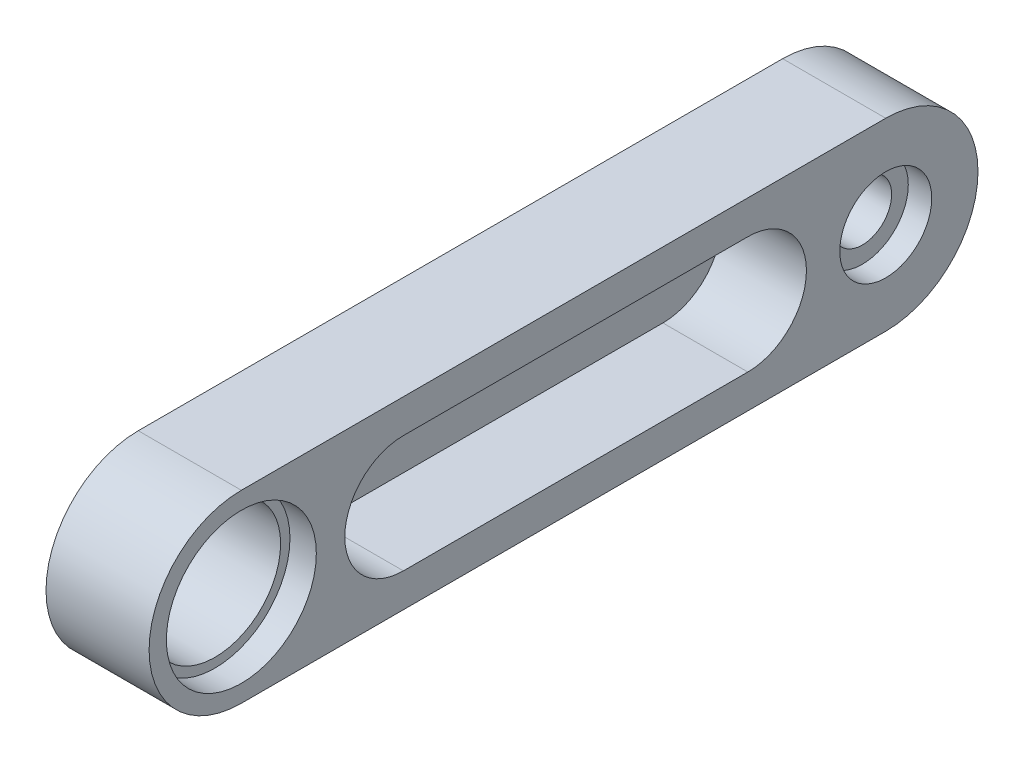
from build123d import *

# Parameters (mm, degrees)
SKETCH1_R           = 2.8448
SKETCH1_R_2         = 1.27
BOSS_EXTRUDE1_DEPTH = 4.4704
SKETCH2_R           = 3.2512
CUT_EXTRUDE1_DEPTH  = 1.143
SKETCH3_R           = 1.9939
CUT_EXTRUDE2_DEPTH  = 1.016
CUT_EXTRUDE3_DEPTH  = 3.683
SCALE1_SCALE        = 0.6


with BuildPart() as part:
    # Sketch1 → Boss-Extrude1 (new body)
    with BuildSketch(Plane(origin=(0, 0, 0), x_dir=(0, 0, -1), z_dir=(1, 0, 0))):
        with BuildLine():
            Line((0, 4.000000128), (27.94, 4.000000128))
            ThreePointArc((27.94, 4.000000128), (31.940000128, 0), (27.94, -4.000000128))
            Line((27.94, -4.000000128), (0, -4.000000128))
            ThreePointArc((0, -4.000000128), (-4.000000128, 0), (0, 4.000000128))
        make_face()
        Circle(SKETCH1_R, mode=Mode.SUBTRACT)
        with Locations((27.94, 0)):
            Circle(SKETCH1_R_2, mode=Mode.SUBTRACT)
    extrude(amount=BOSS_EXTRUDE1_DEPTH)

    # Sketch2 → Cut-Extrude1 (cut)
    with BuildSketch(Plane(origin=(4.4704, 0, 0), x_dir=(0, 0, -1), z_dir=(1, 0, 0))):
        Circle(SKETCH2_R)
    extrude(amount=-CUT_EXTRUDE1_DEPTH, mode=Mode.SUBTRACT)

    # Sketch3 → Cut-Extrude2 (cut)
    with BuildSketch(Plane(origin=(4.4704, 0, 0), x_dir=(0, 0, -1), z_dir=(1, 0, 0))):
        with Locations((27.94, 0)):
            Circle(SKETCH3_R)
    extrude(amount=-CUT_EXTRUDE2_DEPTH, mode=Mode.SUBTRACT)

    # Sketch4 → Cut-Extrude3 (cut)
    with BuildSketch(Plane(origin=(4.4704, 0, 0), x_dir=(0, 0, -1), z_dir=(1, 0, 0))):
        with BuildLine():
            Line((7.0259921, 2.54), (21.9611921, 2.54))
            ThreePointArc((21.9611921, 2.54), (24.5011921, 0), (21.9611921, -2.54))
            Line((21.9611921, -2.54), (7.0259921, -2.54))
            ThreePointArc((7.0259921, -2.54), (4.4859921, 0), (7.0259921, 2.54))
        make_face()
    extrude(amount=-CUT_EXTRUDE3_DEPTH, mode=Mode.SUBTRACT)


with BuildPart() as part_1:
    # Scale1: scaled about (2.002001382, 0, -15.510759507)
    add(part.part.scale(SCALE1_SCALE).moved(Location((0.800800553, 0, -6.204303803))))


solid = part_1.part
